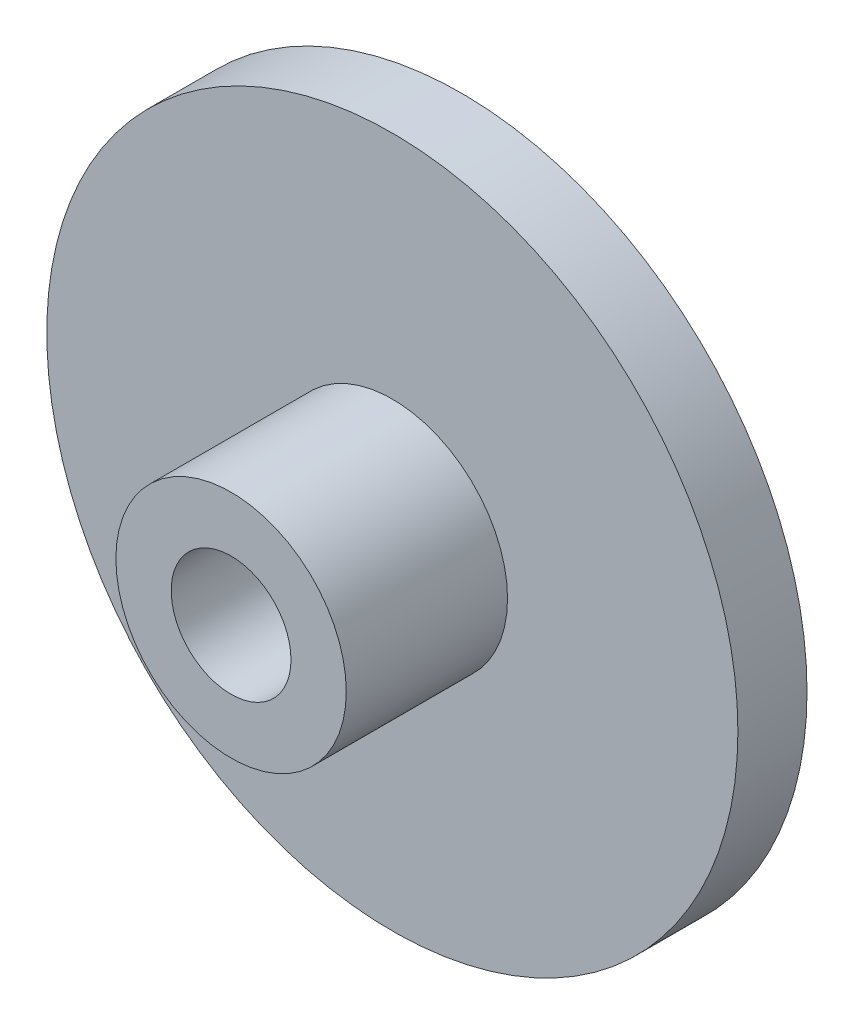
from build123d import *

# Parameters (mm, degrees)
SKETCH_1_R      = 15
EXTRUDE_1_DEPTH = 3
SKETCH_2_R      = 5
SKETCH_2_R_2    = 2.6
EXTRUDE_2_DEPTH = 7


with BuildPart() as part:
    # 草图1 → 凸台-拉伸1 (new body)
    with BuildSketch(Plane.XY):
        Circle(SKETCH_1_R)
    extrude(amount=EXTRUDE_1_DEPTH)

    # 草图2 → 凸台-拉伸2 (add)
    with BuildSketch(Plane.XY.offset(3)):
        Circle(SKETCH_2_R)
        Circle(SKETCH_2_R_2, mode=Mode.SUBTRACT)
    extrude(amount=EXTRUDE_2_DEPTH)


solid = part.part
